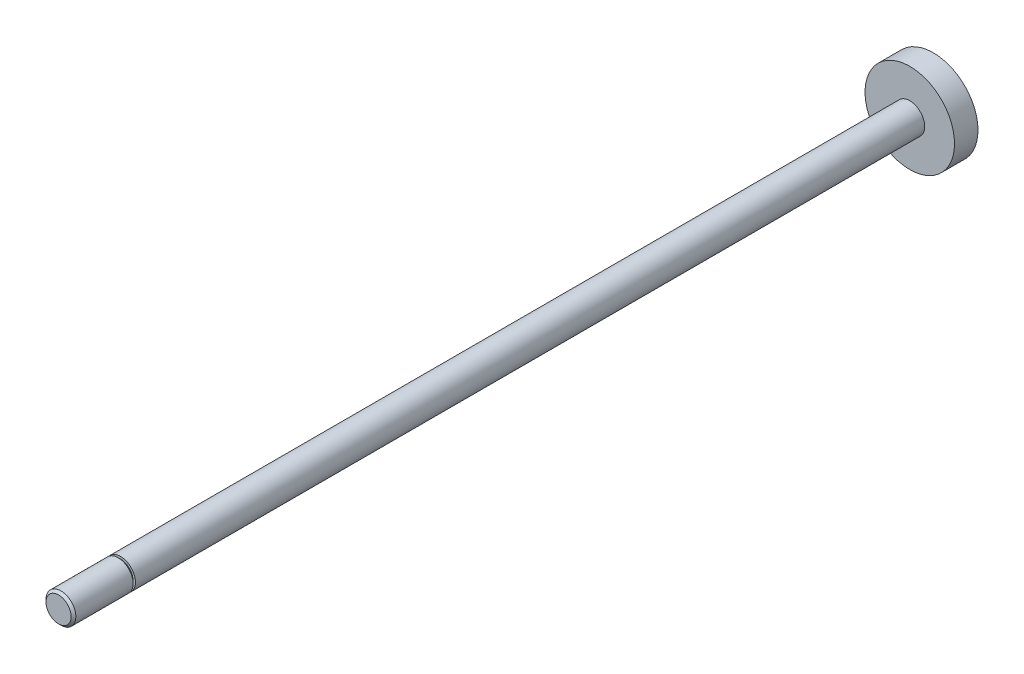
from build123d import *

# Parameters (mm, degrees)
SKETCH1_R      = 3.175
EXTRUDE1_DEPTH = 183.769
SKETCH2_R      = 9.525
PISTON_DEPTH   = 2.5


with BuildPart() as part:
    # Sketch1 → Extrude1 (new body)
    with BuildSketch(Plane.XY):
        with Locations(Location((0, 0, 0), (0, 0, 180))):
            Circle(SKETCH1_R)
    extrude(amount=EXTRUDE1_DEPTH)

    # Sketch2 → Piston (add, symmetric)
    with BuildSketch(Plane.XY):
        Circle(SKETCH2_R)
    extrude(amount=PISTON_DEPTH, both=True)

    # Sketch3 → Threads (revolve, cut)
    with BuildSketch(Plane(origin=(0, 0, 0), x_dir=(0, 0, -1), z_dir=(1, 0, 0)), mode=Mode.PRIVATE) as threads_sk:
        Polygon((-183.769, 9.525), (-170.569, 9.525), (-170.569, 2.675), (-171.069, 2.675), (-171.069, 3.175), (-183.269, 3.175), (-183.769, 2.675), align=None)
    revolve(threads_sk.sketch.rotate(Axis((0, 0, 0), (0, 0, 1)), 90), axis=Axis((0, 0, 0), (0, 0, 1)), mode=Mode.SUBTRACT)


solid = part.part
